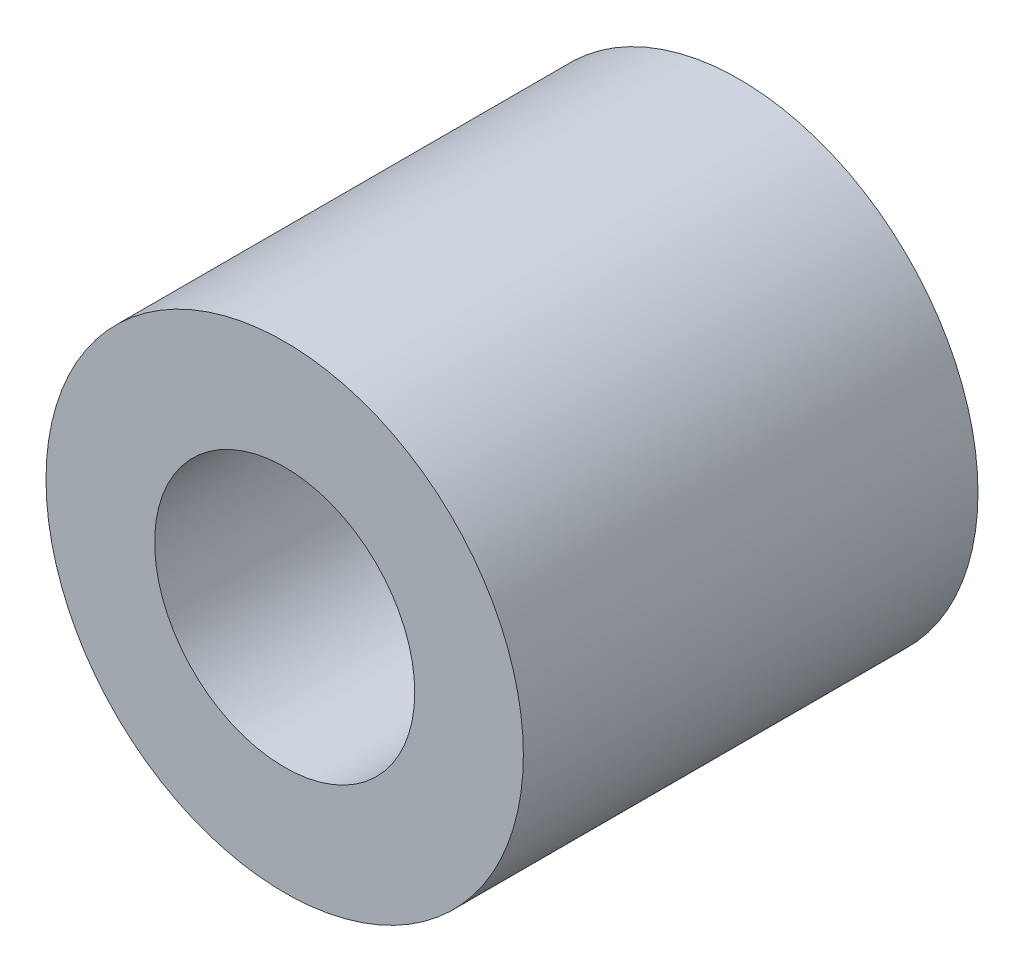
from build123d import *

# Parameters (mm, degrees)
SKETCH1_R           = 9.45
SKETCH1_R_2         = 5.15
BOSS_EXTRUDE1_DEPTH = 18


with BuildPart() as part:
    # Sketch1 → Boss-Extrude1 (new body)
    with BuildSketch(Plane.XY):
        Circle(SKETCH1_R)
        Circle(SKETCH1_R_2, mode=Mode.SUBTRACT)
    extrude(amount=BOSS_EXTRUDE1_DEPTH)


solid = part.part
